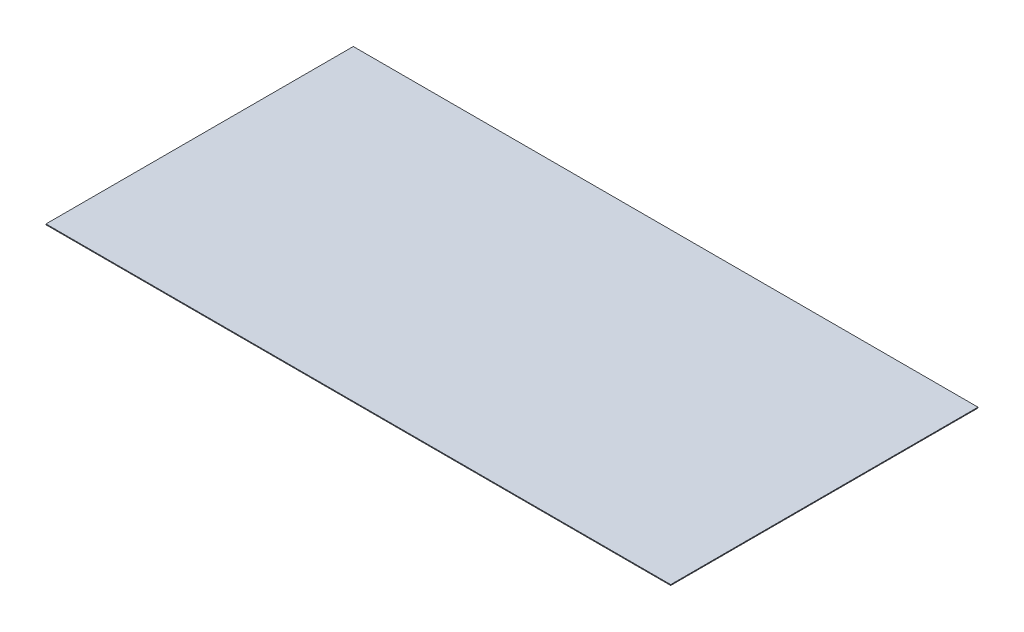
from build123d import *

# Parameters (mm, degrees)
SZKIC1_W                    = 1545
SZKIC1_H                    = 760
DODANIE_WYCI_GNI_CIE1_DEPTH = 2


with BuildPart() as part:
    # Szkic1 → Dodanie-wyciągnięcie1 (new body)
    with BuildSketch(Plane(origin=(0, 0, 0), x_dir=(1, 0, 0), z_dir=(0, 1, 0))):
        with Locations((174.962894273, 16.208530806)):
            Rectangle(SZKIC1_W, SZKIC1_H)
    extrude(amount=DODANIE_WYCI_GNI_CIE1_DEPTH)


solid = part.part
